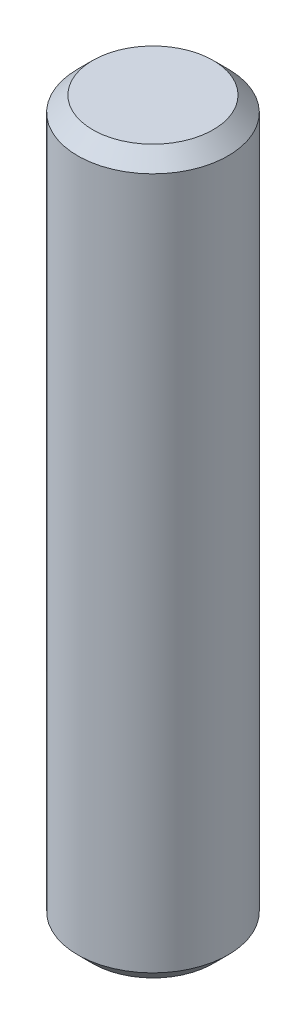
from build123d import *


with BuildPart() as part:
    # Esquisse1 → Révolution1 (revolve)
    with BuildSketch(Plane.XY):
        Polygon((0, 0), (-4, 0), (-5, 1), (-5, 47), (-4, 48), (0, 48), align=None)
    revolve(axis=Axis((0, 48, 0), (0, -1, 0)))


solid = part.part
